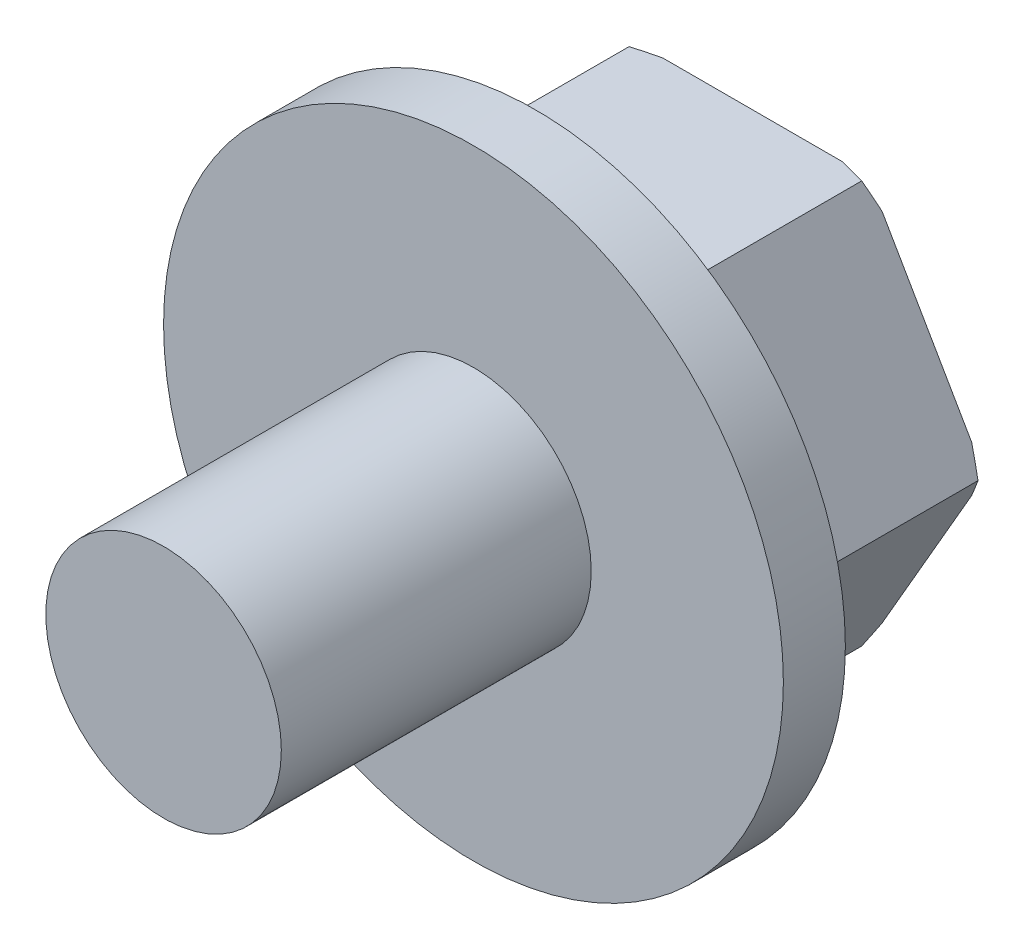
from build123d import *

# Parameters (mm, degrees)
CROQUIS1_R              = 3.8
SALIENTE_EXTRUIR1_DEPTH = 10
CROQUIS3_R              = 10
SALIENTE_EXTRUIR2_DEPTH = 2
SALIENTE_EXTRUIR3_DEPTH = 7
CROQUIS6_R              = 6
CORTAR_EXTRUIR6_DEPTH   = 0.5


with BuildPart() as part:
    # Croquis1 → Saliente-Extruir1 (new body)
    with BuildSketch(Plane.XY):
        Circle(CROQUIS1_R)
    extrude(amount=SALIENTE_EXTRUIR1_DEPTH)

    # Croquis3 → Saliente-Extruir2 (add)
    with BuildSketch(Plane(origin=(0, 0, 0), x_dir=(-1, 0, 0), z_dir=(0, 0, -1))):
        Circle(CROQUIS3_R)
    extrude(amount=SALIENTE_EXTRUIR2_DEPTH)

    # Croquis4 → Saliente-Extruir3 (add)
    with BuildSketch(Plane(origin=(0, 0, -2), x_dir=(-1, 0, 0), z_dir=(0, 0, -1))):
        Polygon((3.75277675, -6.5), (7.505553499, 0), (3.75277675, 6.5), (-3.75277675, 6.5), (-7.505553499, 0), (-3.75277675, -6.5), align=None)
    extrude(amount=SALIENTE_EXTRUIR3_DEPTH)

    # Croquis6 → Cortar-Extruir6 (cut)
    with BuildSketch(Plane(origin=(0, 0, -9), x_dir=(-1, 0, 0), z_dir=(0, 0, -1))):
        Circle(CROQUIS6_R)
    extrude(amount=-CORTAR_EXTRUIR6_DEPTH, mode=Mode.SUBTRACT)

    # Croquis7 → Cortar-Revolución1 (revolve, cut)
    with BuildSketch(Plane(origin=(0, 0, 0), x_dir=(1, 0, 0), z_dir=(0, 1, 0))):
        Polygon((-5.5, 15.2), (-5.5, 9.932050808), (-8.5, 8.2), (-8.5, 15.2), align=None)
    revolve(axis=Axis((0, 0, 0), (0, 0, -1)), mode=Mode.SUBTRACT)


solid = part.part
